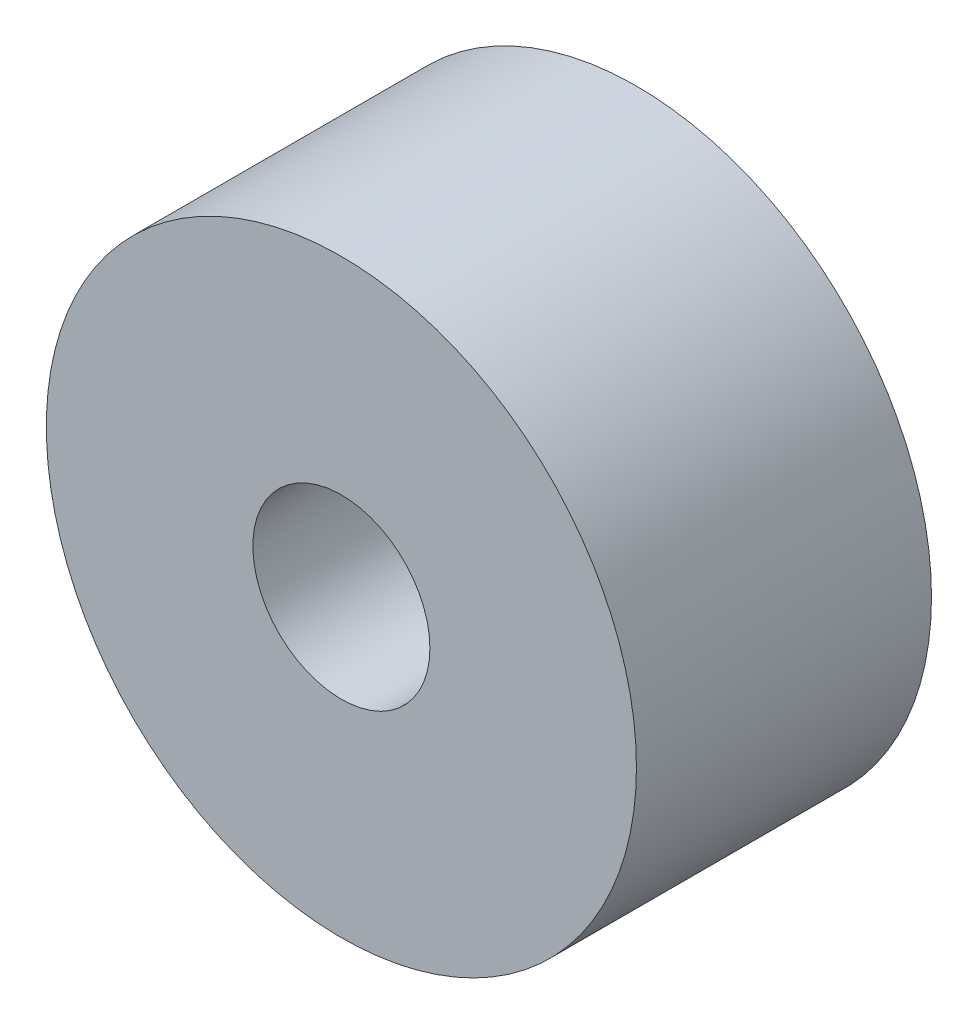
from build123d import *

# Parameters (mm, degrees)
CROQUIS1_R              = 2.5
CROQUIS1_R_2            = 0.75
SALIENTE_EXTRUIR1_DEPTH = 2.5


with BuildPart() as part:
    # Croquis1 → Saliente-Extruir1 (new body)
    with BuildSketch(Plane.XY):
        Circle(CROQUIS1_R)
        Circle(CROQUIS1_R_2, mode=Mode.SUBTRACT)
    extrude(amount=SALIENTE_EXTRUIR1_DEPTH)


solid = part.part
